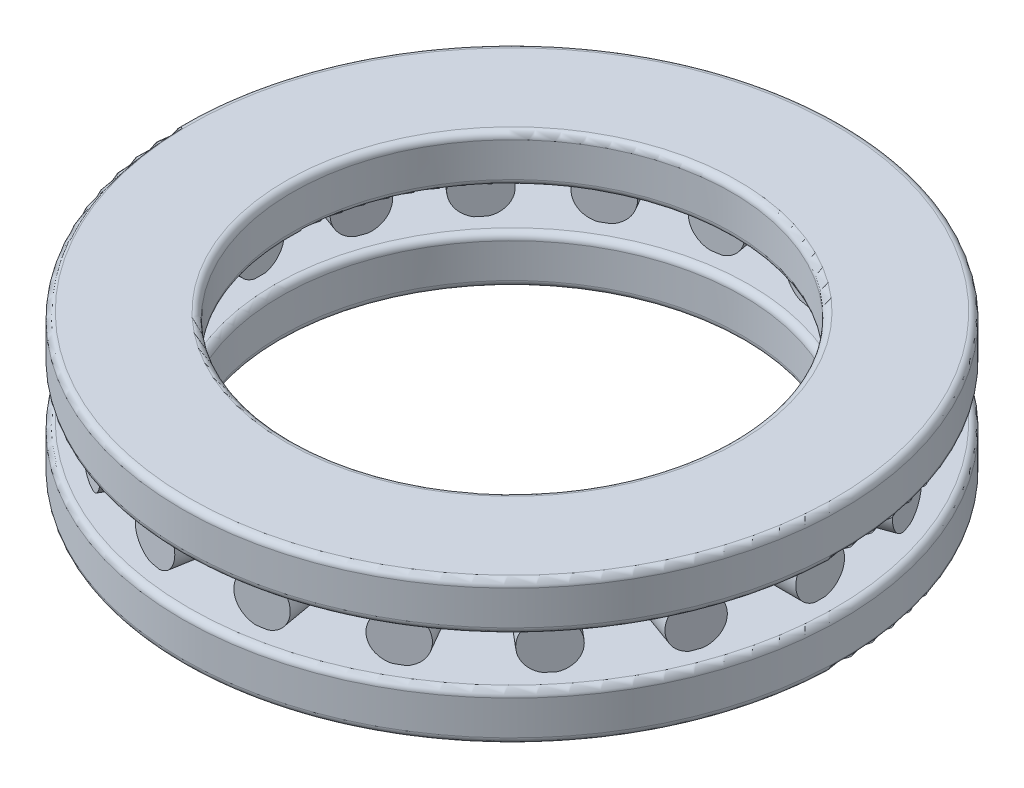
from build123d import *

# Parameters (mm, degrees)
SKETCH_2_W               = 10
SKETCH_2_H               = 4.333333333
SKETCH_3_W               = 5.1
SKETCH_3_H               = 2.216666667
SKETCH_4_W               = 9
SKETCH_4_H               = 4.333333333
PATTERN_CIRCULAR_1_COUNT = 18
FILLET_1_R               = 0.6


with BuildPart() as part:
    # 草图2 → Revolve 717 (revolve)
    with BuildSketch(Plane.XY, mode=Mode.PRIVATE) as revolve_717_sk:
        with Locations((5, 10.833333334)):
            Rectangle(SKETCH_2_W, SKETCH_2_H)
    revolve(revolve_717_sk.sketch.rotate(Axis((30, 13, 0), (0, -1, 0)), 270), axis=Axis((30, 13, 0), (0, -1, 0)))

    # 草图3 → 凸台-旋转1 (revolve)
    with BuildSketch(Plane.XY):
        with Locations((4.5, 7.608333334)):
            Rectangle(SKETCH_3_W, SKETCH_3_H)
    revolve_1 = revolve(axis=Axis((0, 6.5, 0), (1, 0, 0)))

    # 草图4 → 凸台-旋转2 (revolve)
    with BuildSketch(Plane.XY, mode=Mode.PRIVATE) as revolve_2_sk:
        with Locations((4.5, 2.166666667)):
            Rectangle(SKETCH_4_W, SKETCH_4_H)
    revolve(revolve_2_sk.sketch.rotate(Axis((30, 13, 0), (0, -1, 0)), 270), axis=Axis((30, 13, 0), (0, -1, 0)))

    # 阵列(圆周)1: 凸台-旋转1 ×18 about axis
    pattern_circular_1_axis = Axis((30, 0, 0), (0, 1, 0))
    for i in range(1, PATTERN_CIRCULAR_1_COUNT):
        add(revolve_1.rotate(pattern_circular_1_axis, i * 360 / PATTERN_CIRCULAR_1_COUNT))

    # 圆角1
    fillet_1_edges = [part.edges().sort_by_distance(p)[0] for p in [
        (30, 4.333333333, -30),
        (30, 0, -21),
        (30, 4.333333333, -21),
        (30, 0, -30),
        (30, 13, -30),
        (30, 8.666666667, -30),
        (30, 8.666666667, -20),
        (30, 13, -20),
    ]]
    fillet(fillet_1_edges, radius=FILLET_1_R)


solid = part.part
